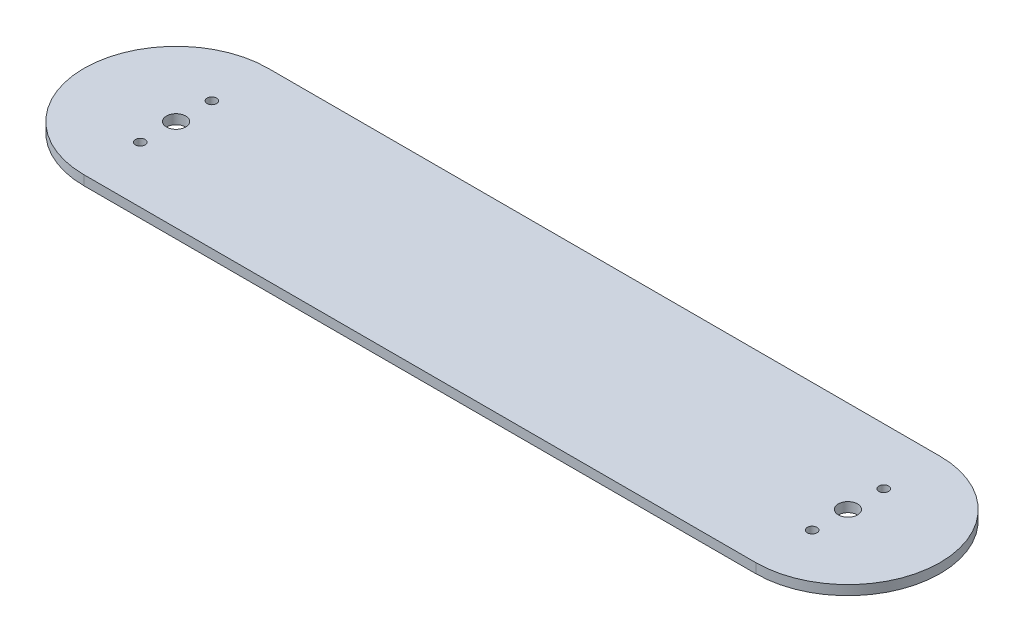
from build123d import *

# Parameters (mm, degrees)
BOSS_EXTRUDE1_DEPTH = 5
SKETCH2_R           = 5
SKETCH2_R_2         = 2.5
CUT_EXTRUDE1_DEPTH  = 10


with BuildPart() as part:
    # Sketch1 → Boss-Extrude1 (new body)
    with BuildSketch(Plane(origin=(0, 0, 0), x_dir=(1, 0, 0), z_dir=(0, 1, 0))):
        with BuildLine():
            Line((-175, 48), (175, 48))
            ThreePointArc((175, 48), (223, 0), (175, -48))
            Line((175, -48), (-175, -48))
            ThreePointArc((-175, -48), (-223, 0), (-175, 48))
        make_face()
    extrude(amount=BOSS_EXTRUDE1_DEPTH)

    # Sketch2 → Cut-Extrude1 (cut)
    with BuildSketch(Plane.XZ):
        with Locations(Location((175, 0, 0), (0, 0, 270))):
            Circle(SKETCH2_R)
        with Locations(Location((175, 18.65, 0), (0, 0, 270))):
            Circle(SKETCH2_R_2)
        with Locations(Location((175, -18.65, 0), (0, 0, 270))):
            Circle(SKETCH2_R_2)
        with Locations(Location((-175, -18.65, 0), (0, 0, 90))):
            Circle(SKETCH2_R_2)
        with Locations(Location((-175, 18.65, 0), (0, 0, 90))):
            Circle(SKETCH2_R_2)
        with Locations(Location((-175, 0, 0), (0, 0, 90))):
            Circle(SKETCH2_R)
    extrude(amount=-CUT_EXTRUDE1_DEPTH, mode=Mode.SUBTRACT)


solid = part.part
